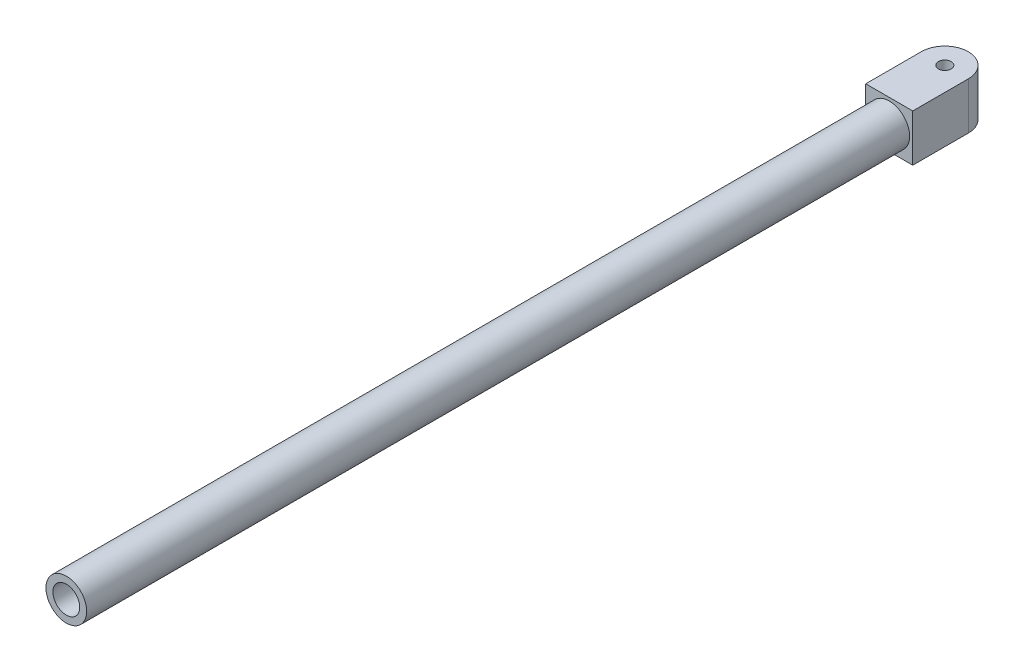
from build123d import *

# Parameters (mm, degrees)
SKETCH1_R           = 9.525
SKETCH1_R_2         = 6.2738
BOSS_EXTRUDE1_DEPTH = 400
SKETCH2_W           = 22
SKETCH2_H           = 22
SKETCH2_R           = 9.525
BOSS_EXTRUDE2_DEPTH = 15
SKETCH2_2_W         = 22
SKETCH2_2_H         = 22
BOSS_EXTRUDE3_DEPTH = 2
SKETCH3_R           = 3
BOSS_EXTRUDE4_DEPTH = 22


with BuildPart() as part:
    # Sketch1 → Boss-Extrude1 (new body)
    with BuildSketch(Plane.XY):
        Circle(SKETCH1_R)
        Circle(SKETCH1_R_2, mode=Mode.SUBTRACT)
    extrude(amount=BOSS_EXTRUDE1_DEPTH)


with BuildPart() as body_2:
    # Sketch2 → Boss-Extrude2 (new body)
    with BuildSketch(Plane(origin=(0, 0, 0), x_dir=(-1, 0, 0), z_dir=(0, 0, -1))):
        Rectangle(SKETCH2_W, SKETCH2_H)
        with Locations(Location((0, 0, 0), (0, 0, 180))):
            Circle(SKETCH2_R, mode=Mode.SUBTRACT)
    extrude(amount=-BOSS_EXTRUDE2_DEPTH)


with BuildPart() as body_3:
    # Sketch2<2> → Boss-Extrude3 (new body)
    with BuildSketch(Plane(origin=(0, 0, 0), x_dir=(-1, 0, 0), z_dir=(0, 0, -1))):
        Rectangle(SKETCH2_2_W, SKETCH2_2_H)
    extrude(amount=BOSS_EXTRUDE3_DEPTH)


with BuildPart() as body_2_1:
    add(body_2.part)

    # Combine1: union body 3
    add(body_3.part)

    # Sketch3 → Boss-Extrude4 (add)
    with BuildSketch(Plane.XZ.offset(11)):
        with BuildLine():
            Line((11, -2), (11, -11))
            ThreePointArc((11, -11), (0, -22), (-11, -11))
            Line((-11, -11), (-11, -2))
            Line((-11, -2), (11, -2))
        make_face()
        with Locations(Location((0, -11, 0), (0, 0, 270))):
            Circle(SKETCH3_R, mode=Mode.SUBTRACT)
    extrude(amount=-BOSS_EXTRUDE4_DEPTH)


solid = Compound([part.part, body_2_1.part])
